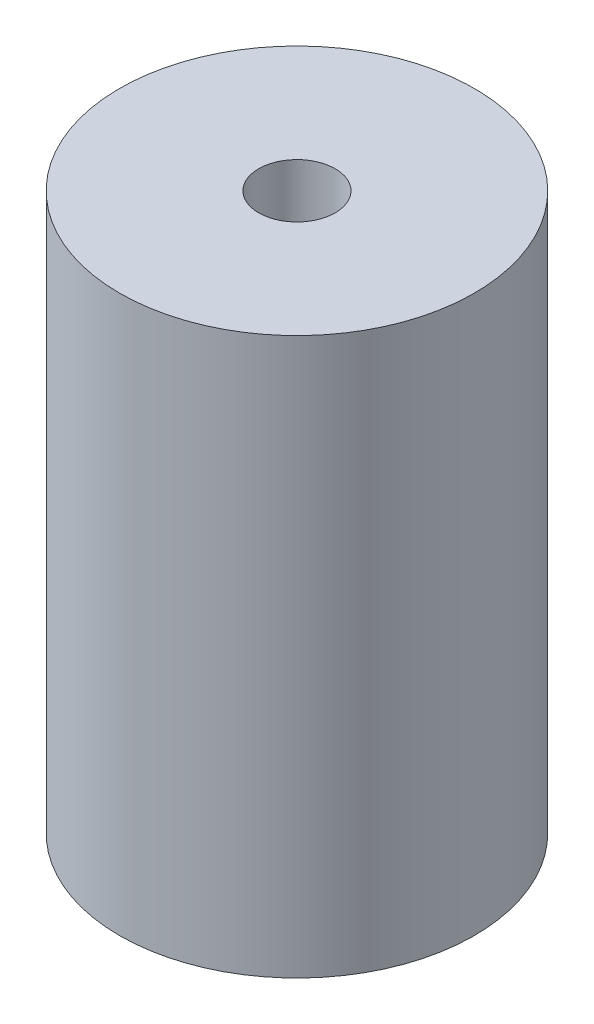
from build123d import *

# Parameters (mm, degrees)
SKETCH1_R      = 25.5
SKETCH1_R_2    = 5.5
EXTRUDE1_DEPTH = 80


with BuildPart() as part:
    # Sketch1 → Extrude1 (new body)
    with BuildSketch(Plane(origin=(0, 0, 0), x_dir=(1, 0, 0), z_dir=(0, 1, 0))):
        with Locations(Location((0, 0, 0), (0, 0, 270))):
            Circle(SKETCH1_R)
        with Locations(Location((0, 0, 0), (0, 0, 270))):
            Circle(SKETCH1_R_2, mode=Mode.SUBTRACT)
    extrude(amount=EXTRUDE1_DEPTH)


solid = part.part
